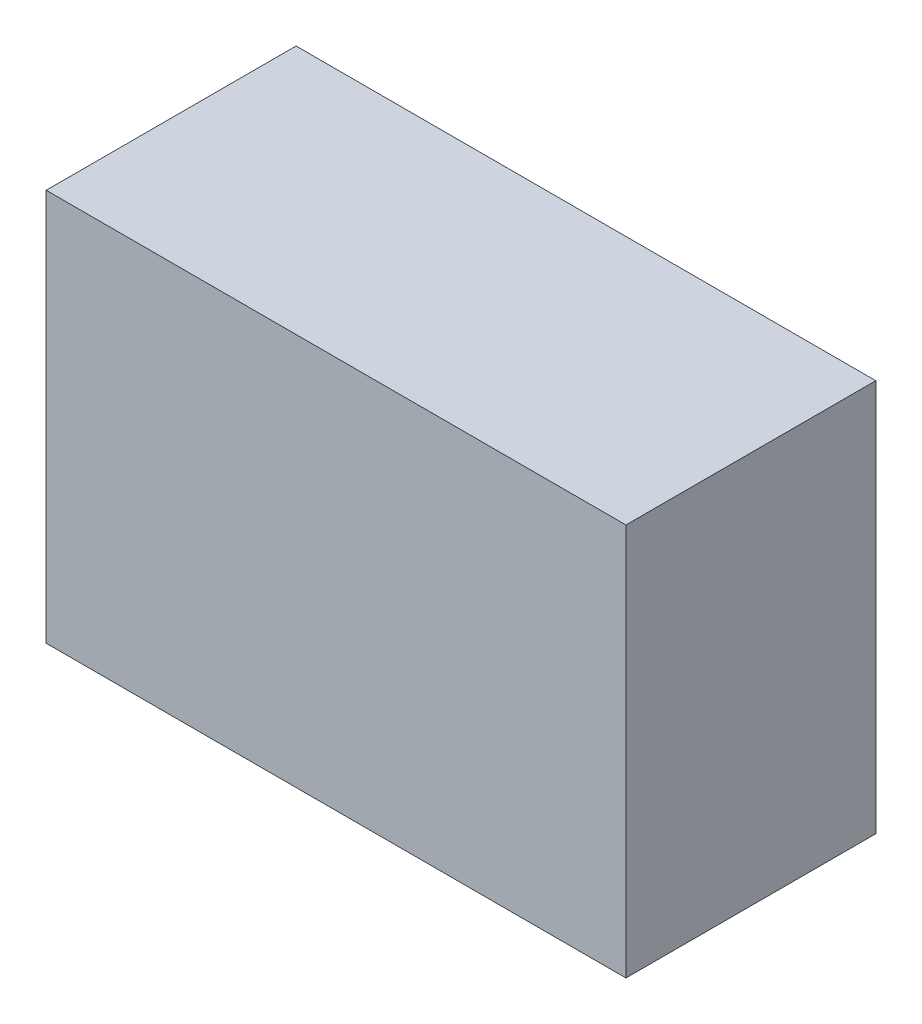
from build123d import *

# Parameters (mm, degrees)
SKETCH1_W           = 150.876
SKETCH1_H           = 65.024
BOSS_EXTRUDE1_DEPTH = 102.108


with BuildPart() as part:
    # Sketch1 → Boss-Extrude1 (new body)
    with BuildSketch(Plane(origin=(0, 0, 0), x_dir=(1, 0, 0), z_dir=(0, 1, 0))):
        Rectangle(SKETCH1_W, SKETCH1_H)
    extrude(amount=BOSS_EXTRUDE1_DEPTH)


solid = part.part
